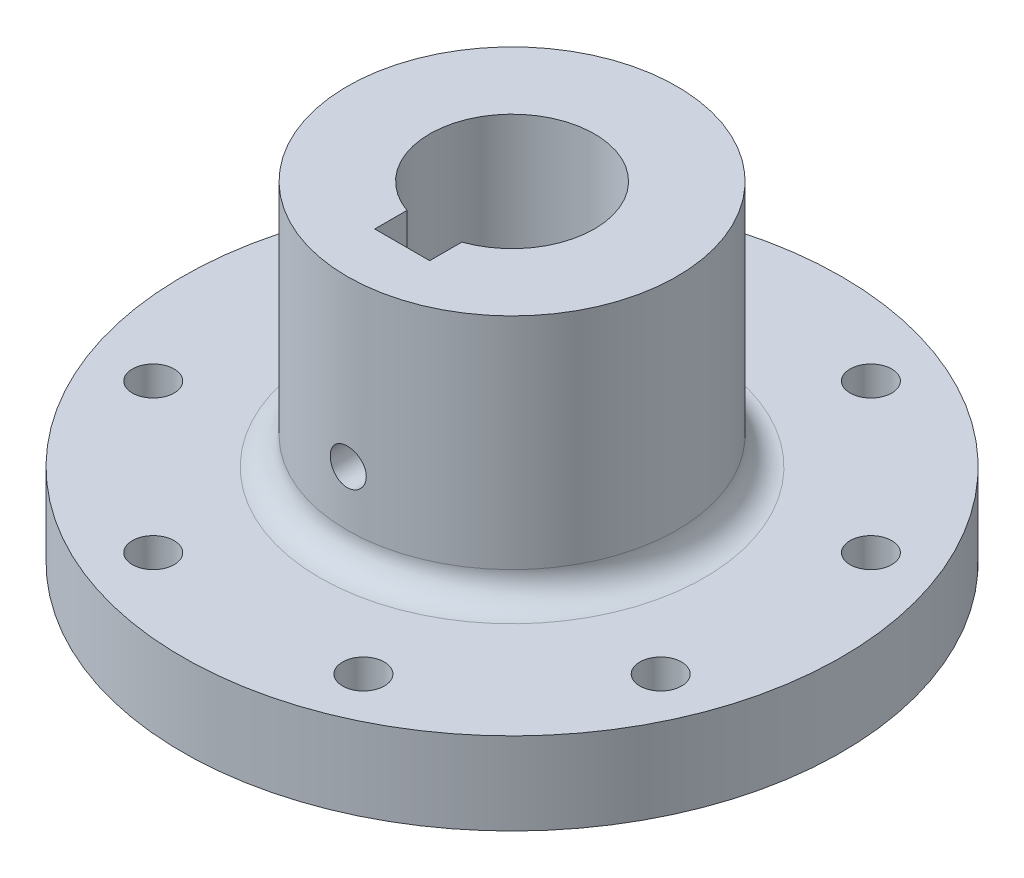
from build123d import *

# Parameters (mm, degrees)
SKETCH1_R              = 38.1
SKETCH1_R_2            = 9.525
BOSS_EXTRUDE1_DEPTH    = 38.1
F_10_32_TAPPED_HOLE1_D = 4.826
CIRPATTERN1_COUNT      = 8
SKETCH4_W              = 6.35
SKETCH4_H              = 6.35
CUT_EXTRUDE1_DEPTH     = 66.991135768
SKETCH5_W              = 2.0828
SKETCH5_H              = 25.4
SKETCH7_OUTSIDE_W      = 101.06
SKETCH7_OUTSIDE_H      = 101.06
SKETCH7_OUTSIDE_R      = 19.05
CUT_EXTRUDE2_DEPTH     = 28.575
FILLET1_R              = 3.175


with BuildPart() as part:
    # Sketch1 → Boss-Extrude1 (new body)
    with BuildSketch(Plane(origin=(0, 0, 0), x_dir=(1, 0, 0), z_dir=(0, 1, 0))):
        with Locations(Location((0, 0, 0), (0, 0, 90))):
            Circle(SKETCH1_R)
        with Locations(Location((0, 0, 0), (0, 0, 90))):
            Circle(SKETCH1_R_2, mode=Mode.SUBTRACT)
    extrude(amount=BOSS_EXTRUDE1_DEPTH)

    # #10-32 Tapped Hole1 (through all)
    with Locations(Plane(origin=(0, 38.1, 0), x_dir=(-1, 0, 0), z_dir=(0, 1, 0))):
        with Locations((29.333175157, -12.150198978)):
            f_10_32_tapped_hole1 = Hole(F_10_32_TAPPED_HOLE1_D / 2)

    # CirPattern1: #10-32 Tapped Hole1 ×8 about axis
    cirpattern1_axis = Axis((0, 0, 0), (0, 1, 0))
    for i in range(1, CIRPATTERN1_COUNT):
        add(f_10_32_tapped_hole1.rotate(cirpattern1_axis, i * 360 / CIRPATTERN1_COUNT), mode=Mode.SUBTRACT)

    # Sketch4 → Cut-Extrude1 (cut, through all)
    with BuildSketch(Plane(origin=(0, 38.1, 0), x_dir=(1, 0, 0), z_dir=(0, 1, 0))):
        with Locations((0, -9.525)):
            Rectangle(SKETCH4_W, SKETCH4_H)
    extrude(amount=-CUT_EXTRUDE1_DEPTH, mode=Mode.SUBTRACT)

    # Sketch5 → #8-32 Tapped Hole1 (revolve, cut)
    with BuildSketch(Plane(origin=(0, 19.05, 12.7), x_dir=(0, 1, 0), z_dir=(1, 0, 0))):
        with Locations((1.0414, 12.7)):
            Rectangle(SKETCH5_W, SKETCH5_H)
    revolve(axis=Axis((0, 19.05, 6.35), (0, 0, 1)), mode=Mode.SUBTRACT)

    # Sketch7 outside → Cut-Extrude2 (cut)
    with BuildSketch(Plane(origin=(0, 38.1, 0), x_dir=(1, 0, 0), z_dir=(0, 1, 0))):
        Rectangle(SKETCH7_OUTSIDE_W, SKETCH7_OUTSIDE_H)
        with Locations(Location((0, 0, 0), (0, 0, 270))):
            Circle(SKETCH7_OUTSIDE_R, mode=Mode.SUBTRACT)
    extrude(amount=-CUT_EXTRUDE2_DEPTH, mode=Mode.SUBTRACT)

    # Fillet1
    fillet1_edges = [part.edges().sort_by_distance(p)[0] for p in [
        (0, 9.525, -19.05),
    ]]
    fillet(fillet1_edges, radius=FILLET1_R)


solid = part.part
